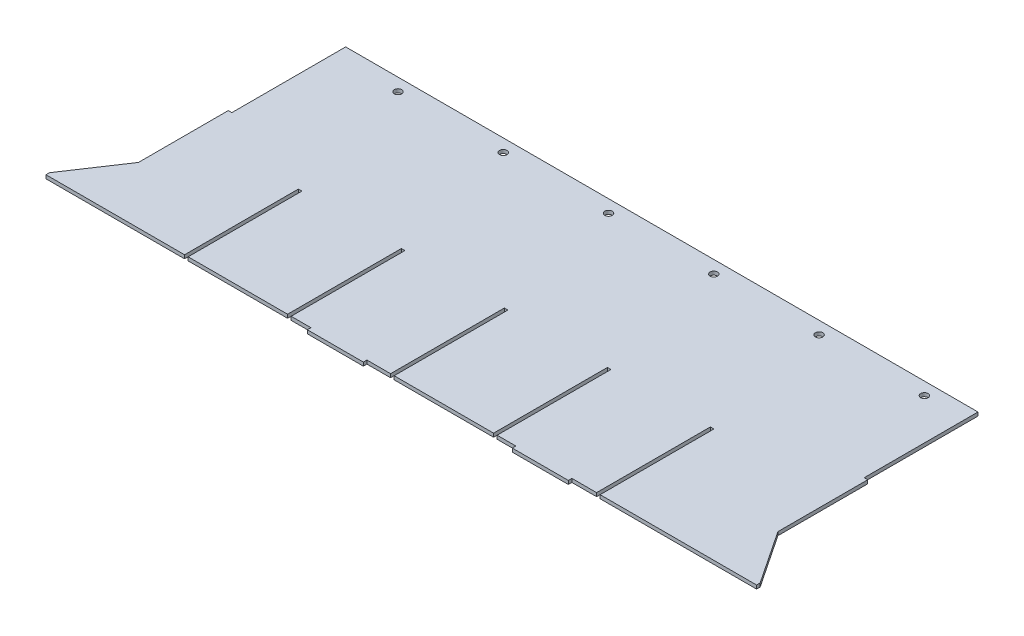
from build123d import *

# Parameters (mm, degrees)
SKETCH1_W           = 570.861
SKETCH1_H           = 3.175
BOSS_EXTRUDE1_DEPTH = 232.6
SKETCH7_R           = 3.302
CUT_EXTRUDE4_DEPTH  = 369.216527271
SKETCH6_W           = 50
SKETCH6_H           = 3.175
BOSS_EXTRUDE2_DEPTH = 3.175
LPATTERN1_COUNT     = 6
LPATTERN1_PITCH     = 93.98
SKETCH2_W           = 3.175
SKETCH2_H           = 101.6
CUT_EXTRUDE5_DEPTH  = 371.230335845
BOSS_EXTRUDE3_DEPTH = 3.175
SKETCH13_W          = 3.175
SKETCH13_H          = 101.6
CUT_EXTRUDE6_DEPTH  = 396.22575932
LPATTERN2_COUNT     = 5
LPATTERN2_PITCH     = 91.9550104


with BuildPart() as part:
    # Sketch1 → Boss-Extrude1 (new body)
    with BuildSketch(Plane.XY):
        Rectangle(SKETCH1_W, SKETCH1_H)
    extrude(amount=BOSS_EXTRUDE1_DEPTH)

    # Sketch7 → Cut-Extrude4 (cut, through all)
    with BuildSketch(Plane(origin=(0, -1.5875, 0), x_dir=(-1, 0, 0), z_dir=(0, -1, 0))):
        with Locations((-245.6805, -11.29165)):
            Circle(SKETCH7_R)
    cut_extrude4 = extrude(amount=-CUT_EXTRUDE4_DEPTH, mode=Mode.SUBTRACT)

    # Sketch6 → Boss-Extrude2 (add)
    with BuildSketch(Plane.XY.offset(232.6)):
        with Locations((127.26300405, 0)):
            Rectangle(SKETCH6_W, SKETCH6_H)
        with Locations((-55.6950692, 0)):
            Rectangle(SKETCH6_W, SKETCH6_H)
    extrude(amount=BOSS_EXTRUDE2_DEPTH)

    # LPattern1: Cut-Extrude4 ×6
    with Locations(*[(-i * LPATTERN1_PITCH, 0, 0) for i in range(1, LPATTERN1_COUNT)]):
        add(cut_extrude4, mode=Mode.SUBTRACT)

    # Sketch2 → Cut-Extrude5 (cut, through all)
    with BuildSketch(Plane(origin=(0, 1.5875, 0), x_dir=(1, 0, 0), z_dir=(0, 1, 0))):
        with Locations((283.843, -50.8)):
            Rectangle(SKETCH2_W, SKETCH2_H)
        with Locations((-283.843, -50.8)):
            Rectangle(SKETCH2_W, SKETCH2_H)
    extrude(amount=-CUT_EXTRUDE5_DEPTH, mode=Mode.SUBTRACT)

    # Sketch12 → Boss-Extrude3 (add)
    with BuildSketch(Plane(origin=(0, 1.5875, 0), x_dir=(1, 0, 0), z_dir=(0, 1, 0))):
        Polygon((-317.1805, -232.6), (-285.4305, -232.6), (-285.4305, -181.8), (-317.1805, -229.425), align=None)
    boss_extrude3 = extrude(amount=-BOSS_EXTRUDE3_DEPTH)

    # Mirror1: Boss-Extrude3 across plane
    add(boss_extrude3.mirror(Plane(origin=(0, 0, 0), x_dir=(0, 0, 1), z_dir=(1, 0, 0))))

    # Sketch13 → Cut-Extrude6 (cut, through all)
    with BuildSketch(Plane.XZ.offset(1.5875)):
        with Locations((-191.8879896, 181.8)):
            Rectangle(SKETCH13_W, SKETCH13_H)
    cut_extrude6 = extrude(amount=-CUT_EXTRUDE6_DEPTH, mode=Mode.SUBTRACT)

    # LPattern2: Cut-Extrude6 ×5
    with Locations(*[(i * LPATTERN2_PITCH, 0, 0) for i in range(1, LPATTERN2_COUNT)]):
        add(cut_extrude6, mode=Mode.SUBTRACT)


solid = part.part
